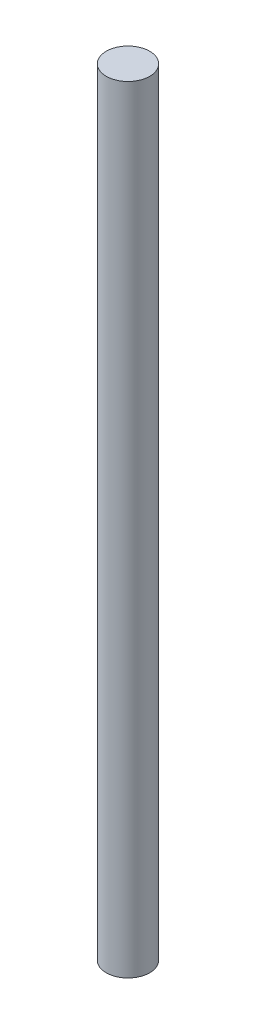
from build123d import *

# Parameters (mm, degrees)
SKETCH1_R           = 0.7
BOSS_EXTRUDE1_DEPTH = 25


with BuildPart() as part:
    # Sketch1 → Boss-Extrude1 (new body)
    with BuildSketch(Plane(origin=(0, 0, 0), x_dir=(1, 0, 0), z_dir=(0, 1, 0))):
        with Locations(Location((0, 0, 0), (0, 0, 270))):
            Circle(SKETCH1_R)
    extrude(amount=BOSS_EXTRUDE1_DEPTH)


solid = part.part
